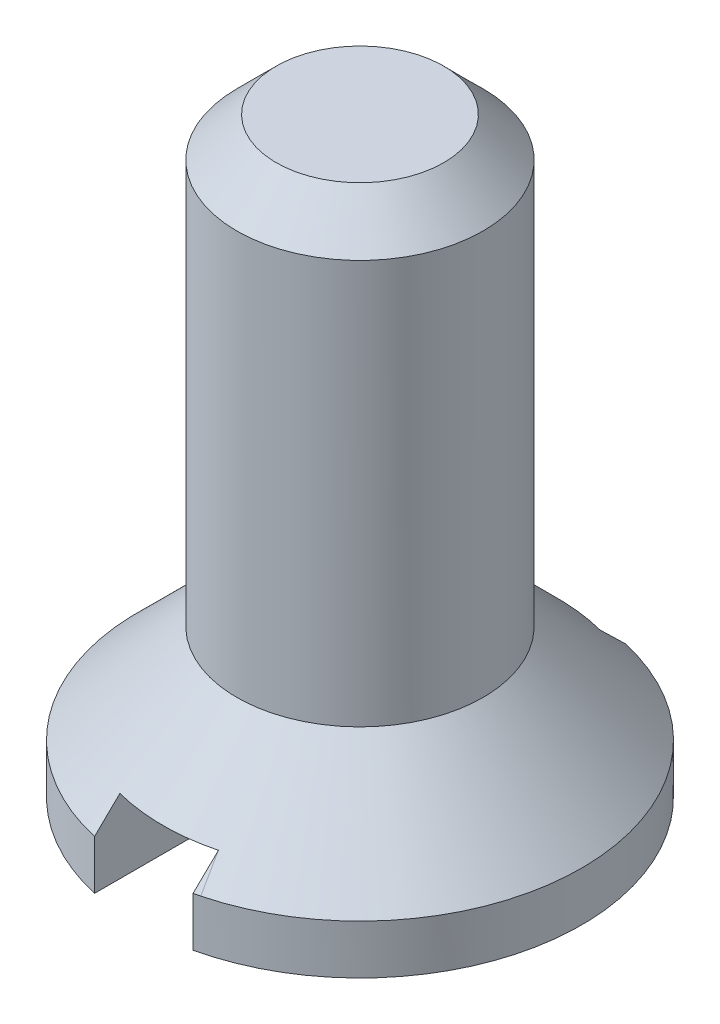
from build123d import *

# Parameters (mm, degrees)
SKETCH_1_W          = 1.25
SKETCH_1_H          = 4.5
SKETCH_2_W          = 1
SKETCH_2_H          = 0.75
CUT_EXTRUDE_1_DEPTH = 10
CHAMFER_1_SIZE      = 0.4


with BuildPart() as part:
    # Эскиз1 → Повернуть1 (revolve)
    with BuildSketch(Plane.XY):
        with Locations((-0.625, 3.75)):
            Rectangle(SKETCH_1_W, SKETCH_1_H)
        Polygon((-2.25, 0), (0, 0), (0, 1.5), (-1.25, 1.5), (-2.25, 0.5), align=None)
    revolve(axis=Axis((0, 6, 0), (0, -1, 0)))

    # Эскиз2 → Вырез-Вытянуть1 (cut, symmetric)
    with BuildSketch(Plane.XY):
        with Locations((0, 0.375)):
            Rectangle(SKETCH_2_W, SKETCH_2_H)
    extrude(amount=CUT_EXTRUDE_1_DEPTH, both=True, mode=Mode.SUBTRACT)

    # Фаска1
    chamfer_1_edges = [part.edges().sort_by_distance(p)[0] for p in [
        (1.25, 6, 0),
    ]]
    chamfer(chamfer_1_edges, length=CHAMFER_1_SIZE)


solid = part.part
